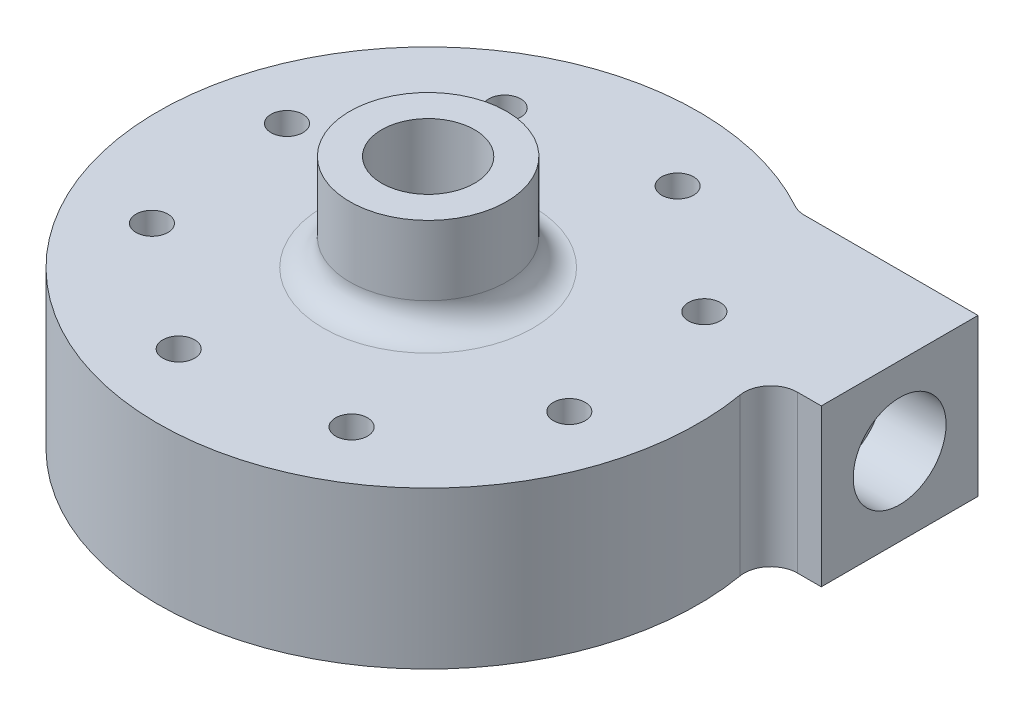
from build123d import *

# Parameters (mm, degrees)
SKETCH1_R            = 101.6
BODY_EXTRUSION_DEPTH = 50.8
SKETCH7_R            = 8.73125
INLET_TAP_DEPTH      = 20
SKETCH6_R            = 5.4102
DE_DEPTH             = 100
SKETCH18_R           = 152.4
TOP_PROFILE_DEPTH    = 76.2
SKETCH19_R           = 8.73125
OUTLET_TAP_DEPTH     = 12
SKETCH20_R           = 3
BOLTS_DEPTH          = 76.2
BOLT_PATTERN_COUNT   = 8
INLET_FILLET_R       = 5


with BuildPart() as part:
    # Sketch1 → body extrusion (new body)
    with BuildSketch(Plane(origin=(0, 0, 0), x_dir=(1, 0, 0), z_dir=(0, 1, 0))):
        with Locations(Location((0, 0, 0), (0, 0, 270))):
            Circle(SKETCH1_R)
    extrude(amount=BODY_EXTRUSION_DEPTH)

    # Sketch7 → inlet tap (cut)
    with BuildSketch(Plane(origin=(0, 50.8, 0), x_dir=(1, 0, 0), z_dir=(0, 1, 0))):
        with Locations(Location((0, 0, 0), (0, 0, 270))):
            Circle(SKETCH7_R)
    extrude(amount=-INLET_TAP_DEPTH, mode=Mode.SUBTRACT)

    # Sketch6 → De (cut)
    with BuildSketch(Plane(origin=(0, 50.8, 0), x_dir=(1, 0, 0), z_dir=(0, 1, 0))):
        with Locations(Location((0, 0, 0), (0, 0, 270))):
            Circle(SKETCH6_R)
    extrude(amount=-DE_DEPTH, mode=Mode.SUBTRACT)

    # Sketch2 → main chamber (revolve, cut)
    with BuildSketch(Plane.XY, mode=Mode.PRIVATE) as main_chamber_sk:
        Polygon((0, 16.506559871), (0, 26.8), (5.4102, 26.8), (30.626685, 20.276511563), (30.626685, 16.506559871), (30.626685, 0), (0, 0), align=None)
    revolve(main_chamber_sk.sketch.rotate(Axis((0, 16.506559871, 0), (0, 1, 0)), 90), axis=Axis((0, 16.506559871, 0), (0, 1, 0)), mode=Mode.SUBTRACT)

    # Sketch11 → conical outlet (revolve, cut)
    with BuildSketch(Plane.XY.offset(-29.153093404)):
        Polygon((0, 19.45537101), (99.619469809, 28.170945284), (99.619469809, 17.990511563), (0, 17.990511563), align=None)
    revolve(axis=Axis((0, 17.990511563, -29.153093404), (1, 0, 0)), mode=Mode.SUBTRACT)

    # Sketch18 → top profile (cut)
    with BuildSketch(Plane(origin=(0, 50.8, 0), x_dir=(1, 0, 0), z_dir=(0, 1, 0))):
        Circle(SKETCH18_R)
        with BuildLine():
            Line((59.485679467, 43.884343404), (26.906522814, 43.884343404))
            ThreePointArc((26.906522814, 43.884343404), (25.661851682, 44.041741441), (24.495544067, 44.504025895))
            ThreePointArc((24.495544067, 44.504025895), (-41.3848353, -29.460743494), (50.070599277, 8.577592203))
            ThreePointArc((50.070599277, 8.577592203), (51.176422748, 12.64509828), (54.998807868, 14.421843404))
            Line((54.998807868, 14.421843404), (59.485679467, 14.421843404))
            Line((59.485679467, 14.421843404), (59.485679467, 43.884343404))
        make_face(mode=Mode.SUBTRACT)
    extrude(amount=-TOP_PROFILE_DEPTH, mode=Mode.SUBTRACT)

    # Sketch19 → outlet tap (cut)
    with BuildSketch(Plane(origin=(59.485679467, 0, 0), x_dir=(0, 0, -1), z_dir=(1, 0, 0))):
        with Locations((29.153093404, 17.990511563)):
            Circle(SKETCH19_R)
    extrude(amount=-OUTLET_TAP_DEPTH, mode=Mode.SUBTRACT)

    # Sketch14 → upper lower cuts (revolve, cut)
    with BuildSketch(Plane.XY, mode=Mode.PRIVATE) as upper_lower_cuts_sk:
        Polygon((14.73125, 50.8), (14.73125, 32.721761563), (50.8, 32.721761563), (127, 32.721761563), (127, 50.8), (50.8, 50.8), align=None)
        Polygon((0, 0), (0, 3.259261563), (50.8, 3.259261563), (127, 3.259261563), (127, 0), (50.8, 0), align=None)
    revolve(upper_lower_cuts_sk.sketch.rotate(Axis((0, 0, 0), (0, 1, 0)), 89.8166316), axis=Axis((0, 0, 0), (0, 1, 0)), mode=Mode.SUBTRACT)

    # Sketch20 → bolts (cut)
    with BuildSketch(Plane(origin=(0, 32.721761563, 0), x_dir=(1, 0, 0), z_dir=(0, 1, 0))):
        with Locations(Location((33.158882246, 18.76428864, 0), (0, 0, 270))):
            Circle(SKETCH20_R)
    bolts = extrude(amount=-BOLTS_DEPTH, mode=Mode.SUBTRACT)

    # bolt pattern: bolts ×8 about axis
    bolt_pattern_axis = Axis((0, 0, 0), (0, 1, 0))
    for i in range(1, BOLT_PATTERN_COUNT):
        add(bolts.rotate(bolt_pattern_axis, i * 360 / BOLT_PATTERN_COUNT), mode=Mode.SUBTRACT)

    # inlet fillet
    inlet_fillet_edges = [part.edges().sort_by_distance(p)[0] for p in [
        (-0.047145552, 32.721761563, 14.731174558),
    ]]
    fillet(inlet_fillet_edges, radius=INLET_FILLET_R)


solid = part.part
